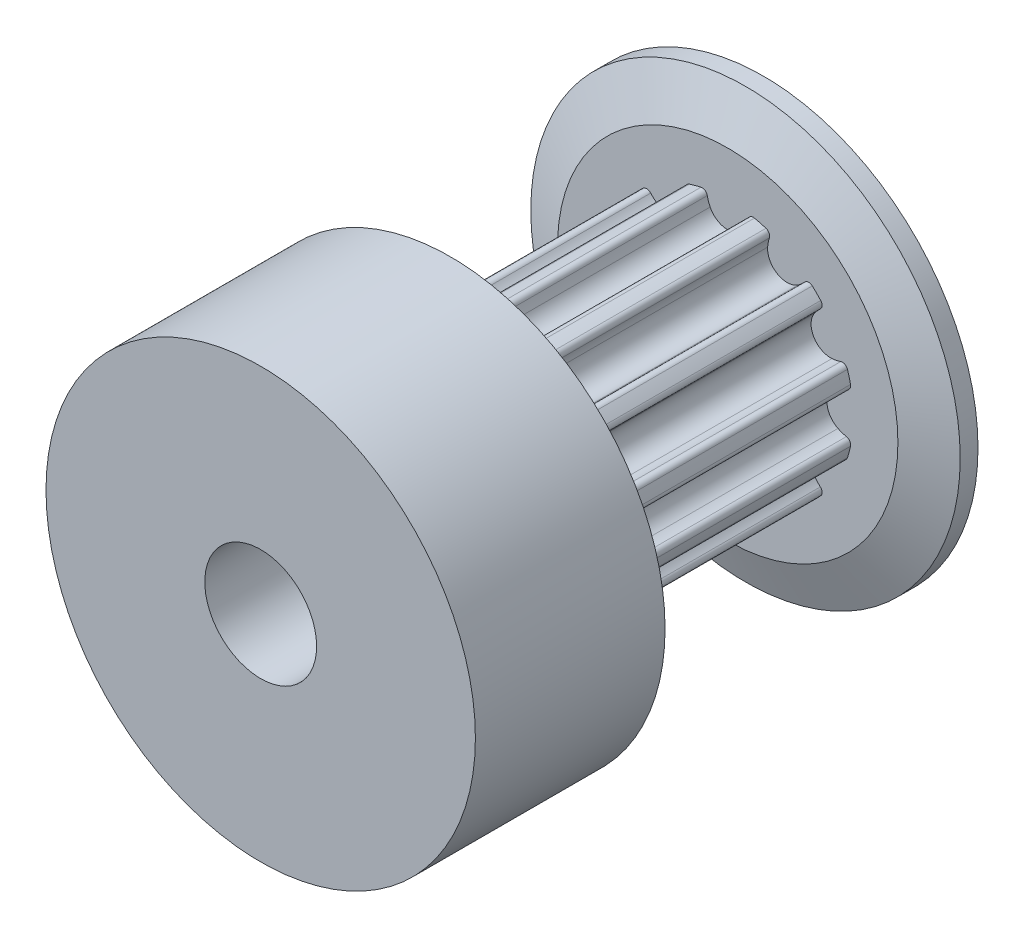
from build123d import *

# Parameters (mm, degrees)
CUT_EXTRUDE1_START = 1.245
CUT_EXTRUDE1_DEPTH = 7.37
CIRPATTERN1_COUNT  = 12


with BuildPart() as part:
    # Sketch2 → Revolve1 (revolve)
    with BuildSketch(Plane(origin=(0, 0, 0), x_dir=(0, 0, -1), z_dir=(1, 0, 0)), mode=Mode.PRIVATE) as revolve1_sk:
        Polygon((-7.135, 1.5875), (7.135, 1.5875), (7.135, 6.096), (6.63, 6.096), (6.125, 4.83225), (6.125, 3.5685), (-1.245, 3.5685), (-1.245, 4.83225), (-1.75, 6.096), (-7.135, 6.096), align=None)
    revolve(revolve1_sk.sketch.rotate(Axis((0, 0, 7.135), (0, 0, -1)), 90), axis=Axis((0, 0, 7.135), (0, 0, -1)))

    # Sketch3 → Cut-Extrude1 (cut)
    with BuildSketch(Plane.XY.offset(CUT_EXTRUDE1_START)):
        with BuildLine():
            Line((3.566654882, 6.096), (-3.566654882, 6.096))
            Line((-3.566654882, 6.096), (-1.802078902, 3.080049331))
            ThreePointArc((-1.802078902, 3.080049331), (-1.296607682, 3.324605355), (-0.759031417, 3.486841487))
            ThreePointArc((-0.759031417, 3.486841487), (-0.645131247, 3.465879975), (-0.580109509, 3.370042573))
            ThreePointArc((-0.580109509, 3.370042573), (-0.547109503, 3.247589437), (-0.498876404, 3.130297753))
            ThreePointArc((-0.498876404, 3.130297753), (0, 2.8185), (0.498876404, 3.130297753))
            ThreePointArc((0.498876404, 3.130297753), (0.547109503, 3.247589437), (0.580109509, 3.370042573))
            ThreePointArc((0.580109509, 3.370042573), (0.645131247, 3.465879975), (0.759031417, 3.486841487))
            ThreePointArc((0.759031417, 3.486841487), (1.296607682, 3.324605355), (1.802078902, 3.080049331))
            Line((1.802078902, 3.080049331), (3.566654882, 6.096))
        make_face()
    cut_extrude1 = extrude(amount=-CUT_EXTRUDE1_DEPTH, mode=Mode.SUBTRACT)

    # CirPattern1: Cut-Extrude1 ×12 about axis
    cirpattern1_axis = Axis((0, 0, 0), (0, 0, 1))
    for i in range(1, CIRPATTERN1_COUNT):
        add(cut_extrude1.rotate(cirpattern1_axis, i * 360 / CIRPATTERN1_COUNT), mode=Mode.SUBTRACT)


solid = part.part
